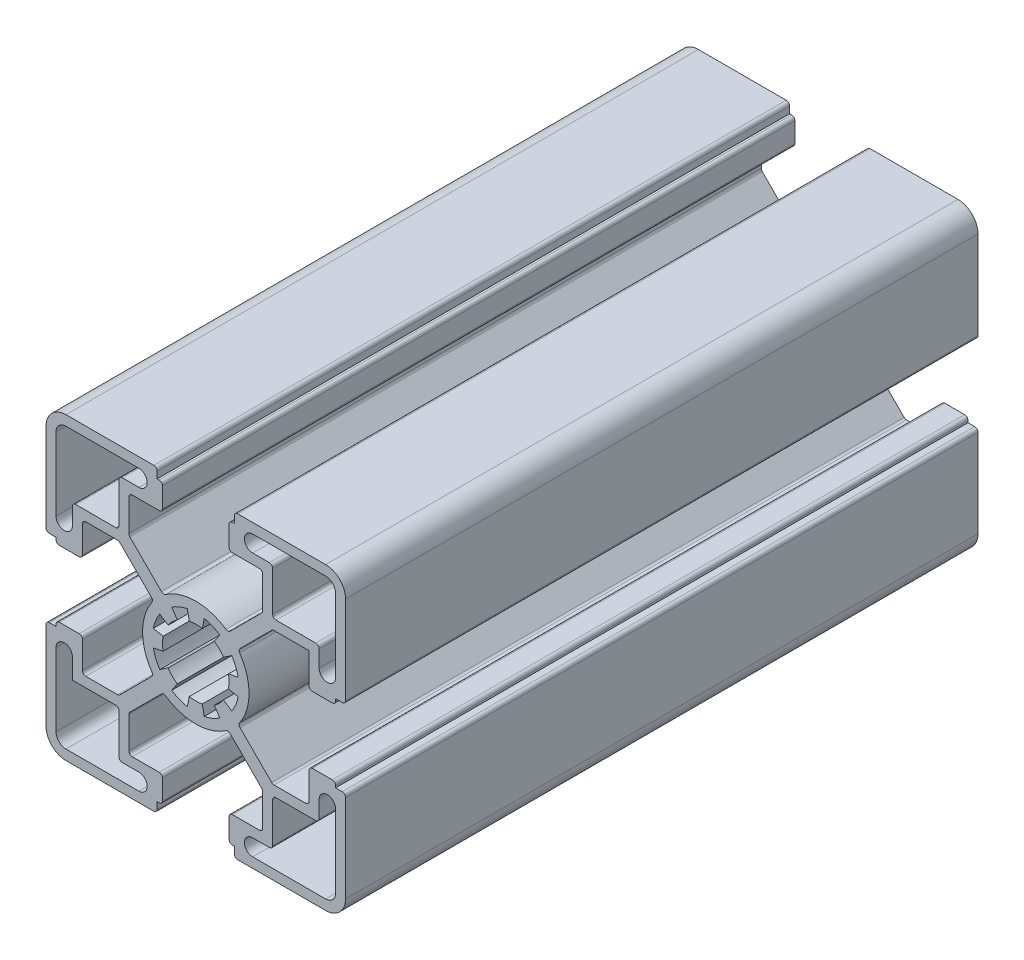
from build123d import *

# Parameters (mm, degrees)
BOSS_EXTRUDE1_DEPTH      = 47.5
BOSS_EXTRUDE1_DEPTH_BACK = 47.5
SKETCH3_R                = 5
FILLET1_R                = 0.5
CUT_EXTRUDE1_DEPTH       = 101.187324548


with BuildPart() as part:
    # Sketch3 → Boss-Extrude1 (new, two sides: drawn at the far end of the back side and taken through both)
    with BuildSketch(Plane.XY.offset(-BOSS_EXTRUDE1_DEPTH_BACK)):
        with BuildLine():
            Line((-11.55, -10.05), (-6.356915373, -4.856915373))
            ThreePointArc((-6.356915373, -4.856915373), (-8, 0), (-6.356915373, 4.856915373))
            Line((-6.356915373, 4.856915373), (-11.55, 10.05))
            Line((-11.55, 10.05), (-17.025, 10.05))
            Line((-17.025, 10.05), (-17.025, 5))
            Line((-17.025, 5), (-21, 5))
            Line((-21, 5), (-21, 5.8))
            Line((-21, 5.8), (-22.5, 5.8))
            Line((-22.5, 5.8), (-22.5, 19.5))
            ThreePointArc((-22.5, 19.5), (-21.621320344, 21.621320344), (-19.5, 22.5))
            Line((-19.5, 22.5), (-5.8, 22.5))
            Line((-5.8, 22.5), (-5.8, 21))
            Line((-5.8, 21), (-5, 21))
            Line((-5, 21), (-5, 17.025))
            Line((-5, 17.025), (-10.05, 17.025))
            Line((-10.05, 17.025), (-10.05, 11.55))
            Line((-10.05, 11.55), (-4.856915373, 6.356915373))
            ThreePointArc((-4.856915373, 6.356915373), (0, 8), (4.856915373, 6.356915373))
            Line((4.856915373, 6.356915373), (10.05, 11.55))
            Line((10.05, 11.55), (10.05, 17.025))
            Line((10.05, 17.025), (5, 17.025))
            Line((5, 17.025), (5, 21))
            Line((5, 21), (5.8, 21))
            Line((5.8, 21), (5.8, 22.5))
            Line((5.8, 22.5), (19.5, 22.5))
            ThreePointArc((19.5, 22.5), (21.621320344, 21.621320344), (22.5, 19.5))
            Line((22.5, 19.5), (22.5, 5.8))
            Line((22.5, 5.8), (21, 5.8))
            Line((21, 5.8), (21, 5))
            Line((21, 5), (17.025, 5))
            Line((17.025, 5), (17.025, 10.05))
            Line((17.025, 10.05), (11.55, 10.05))
            Line((11.55, 10.05), (6.356915373, 4.856915373))
            ThreePointArc((6.356915373, 4.856915373), (8, 0), (6.356915373, -4.856915373))
            Line((6.356915373, -4.856915373), (11.55, -10.05))
            Line((11.55, -10.05), (17.025, -10.05))
            Line((17.025, -10.05), (17.025, -5))
            Line((17.025, -5), (21, -5))
            Line((21, -5), (21, -5.8))
            Line((21, -5.8), (22.5, -5.8))
            Line((22.5, -5.8), (22.5, -19.5))
            ThreePointArc((22.5, -19.5), (21.621320344, -21.621320344), (19.5, -22.5))
            Line((19.5, -22.5), (5.8, -22.5))
            Line((5.8, -22.5), (5.8, -21))
            Line((5.8, -21), (5, -21))
            Line((5, -21), (5, -17.025))
            Line((5, -17.025), (10.05, -17.025))
            Line((10.05, -17.025), (10.05, -11.55))
            Line((10.05, -11.55), (4.856915373, -6.356915373))
            ThreePointArc((4.856915373, -6.356915373), (0, -8), (-4.856915373, -6.356915373))
            Line((-4.856915373, -6.356915373), (-10.05, -11.55))
            Line((-10.05, -11.55), (-10.05, -17.025))
            Line((-10.05, -17.025), (-5, -17.025))
            Line((-5, -17.025), (-5, -21))
            Line((-5, -21), (-5.8, -21))
            Line((-5.8, -21), (-5.8, -22.5))
            Line((-5.8, -22.5), (-19.5, -22.5))
            ThreePointArc((-19.5, -22.5), (-21.621320344, -21.621320344), (-22.5, -19.5))
            Line((-22.5, -19.5), (-22.5, -5.8))
            Line((-22.5, -5.8), (-21, -5.8))
            Line((-21, -5.8), (-21, -5))
            Line((-21, -5), (-17.025, -5))
            Line((-17.025, -5), (-17.025, -10.05))
            Line((-17.025, -10.05), (-11.55, -10.05))
        make_face()
        Circle(SKETCH3_R, mode=Mode.SUBTRACT)
        with BuildLine():
            Line((-21, 8.5375), (-21, 19.5))
            ThreePointArc((-21, 19.5), (-20.560660172, 20.560660172), (-19.5, 21))
            Line((-19.5, 21), (-8.5375, 21))
            ThreePointArc((-8.5375, 21), (-7.3, 19.7625), (-8.5375, 18.525))
            Line((-8.5375, 18.525), (-11.55, 18.525))
            Line((-11.55, 18.525), (-11.55, 11.55))
            Line((-11.55, 11.55), (-18.525, 11.55))
            Line((-18.525, 11.55), (-18.525, 8.5375))
            ThreePointArc((-18.525, 8.5375), (-19.7625, 7.3), (-21, 8.5375))
        make_face(mode=Mode.SUBTRACT)
        with BuildLine():
            Line((8.5375, 21), (19.5, 21))
            ThreePointArc((19.5, 21), (20.560660172, 20.560660172), (21, 19.5))
            Line((21, 19.5), (21, 8.5375))
            ThreePointArc((21, 8.5375), (19.7625, 7.3), (18.525, 8.5375))
            Line((18.525, 8.5375), (18.525, 11.55))
            Line((18.525, 11.55), (11.55, 11.55))
            Line((11.55, 11.55), (11.55, 18.525))
            Line((11.55, 18.525), (8.5375, 18.525))
            ThreePointArc((8.5375, 18.525), (7.3, 19.7625), (8.5375, 21))
        make_face(mode=Mode.SUBTRACT)
        with BuildLine():
            Line((21, -8.5375), (21, -19.5))
            ThreePointArc((21, -19.5), (20.560660172, -20.560660172), (19.5, -21))
            Line((19.5, -21), (8.5375, -21))
            ThreePointArc((8.5375, -21), (7.3, -19.7625), (8.5375, -18.525))
            Line((8.5375, -18.525), (11.55, -18.525))
            Line((11.55, -18.525), (11.55, -11.55))
            Line((11.55, -11.55), (18.525, -11.55))
            Line((18.525, -11.55), (18.525, -8.5375))
            ThreePointArc((18.525, -8.5375), (19.7625, -7.3), (21, -8.5375))
        make_face(mode=Mode.SUBTRACT)
        with BuildLine():
            Line((-8.5375, -21), (-19.5, -21))
            ThreePointArc((-19.5, -21), (-20.560660172, -20.560660172), (-21, -19.5))
            Line((-21, -19.5), (-21, -8.5375))
            ThreePointArc((-21, -8.5375), (-19.7625, -7.3), (-18.525, -8.5375))
            Line((-18.525, -8.5375), (-18.525, -11.55))
            Line((-18.525, -11.55), (-11.55, -11.55))
            Line((-11.55, -11.55), (-11.55, -18.525))
            Line((-11.55, -18.525), (-8.5375, -18.525))
            ThreePointArc((-8.5375, -18.525), (-7.3, -19.7625), (-8.5375, -21))
        make_face(mode=Mode.SUBTRACT)
    extrude(amount=BOSS_EXTRUDE1_DEPTH + BOSS_EXTRUDE1_DEPTH_BACK)

    # Fillet1
    fillet1_edges = [part.edges().sort_by_distance(p)[0] for p in [
        (-11.55, -18.525, 0),
        (-11.55, -11.55, 0),
        (18.525, -11.55, 0),
        (11.55, -11.55, 0),
        (11.55, -18.525, 0),
        (11.55, 18.525, 0),
        (11.55, 11.55, 0),
        (18.525, 11.55, 0),
        (-18.525, 11.55, 0),
        (-11.55, 11.55, 0),
        (-11.55, 18.525, 0),
        (6.356915373, -4.856915373, 0),
        (11.55, -10.05, 0),
        (17.025, -10.05, 0),
        (17.025, -5, 0),
        (21, -5, 0),
        (22.5, -5.8, 0),
        (5.8, -22.5, 0),
        (5, -21, 0),
        (5, -17.025, 0),
        (10.05, -17.025, 0),
        (10.05, -11.55, 0),
        (4.856915373, -6.356915373, 0),
        (-4.856915373, -6.356915373, 0),
        (-10.05, -11.55, 0),
        (-10.05, -17.025, 0),
        (-5, -17.025, 0),
        (-5, -21, 0),
        (-5.8, -22.5, 0),
        (-22.5, -5.8, 0),
        (-21, -5, 0),
        (-17.025, -5, 0),
        (-17.025, -10.05, 0),
        (-11.55, -10.05, 0),
        (-6.356915373, -4.856915373, 0),
        (-6.356915373, 4.856915373, 0),
        (-11.55, 10.05, 0),
        (-17.025, 10.05, 0),
        (-17.025, 5, 0),
        (-21, 5, 0),
        (-22.5, 5.8, 0),
        (-5.8, 22.5, 0),
        (-5, 21, 0),
        (-5, 17.025, 0),
        (-10.05, 17.025, 0),
        (-10.05, 11.55, 0),
        (-4.856915373, 6.356915373, 0),
        (4.856915373, 6.356915373, 0),
        (10.05, 11.55, 0),
        (10.05, 17.025, 0),
        (5, 17.025, 0),
        (5, 21, 0),
        (5.8, 22.5, 0),
        (22.5, 5.8, 0),
        (21, 5, 0),
        (17.025, 5, 0),
        (11.55, 10.05, 0),
        (6.356915373, 4.856915373, 0),
    ]]
    fillet(fillet1_edges, radius=FILLET1_R)

    # Sketch4 → Cut-Extrude1 (cut, through all)
    with BuildSketch(Plane.XY.offset(47.5)):
        with BuildLine():
            Line((-1.268087093, 6.375104323), (-0.97545161, 4.903926402))
            ThreePointArc((-0.97545161, 4.903926402), (-1.913417162, 4.619397663), (-2.777851165, 4.157348062))
            Line((-2.777851165, 4.157348062), (-3.611206515, 5.40455248))
            ThreePointArc((-3.611206515, 5.40455248), (-2.48744231, 6.005216961), (-1.268087093, 6.375104323))
        make_face()
        with BuildLine():
            Line((1.268087093, 6.375104323), (0.97545161, 4.903926402))
            ThreePointArc((0.97545161, 4.903926402), (1.913417162, 4.619397663), (2.777851165, 4.157348062))
            Line((2.777851165, 4.157348062), (3.611206515, 5.40455248))
            ThreePointArc((3.611206515, 5.40455248), (2.48744231, 6.005216961), (1.268087093, 6.375104323))
        make_face()
        with BuildLine():
            Line((5.40455248, 3.611206515), (4.157348062, 2.777851165))
            ThreePointArc((4.157348062, 2.777851165), (4.619397663, 1.913417162), (4.903926402, 0.97545161))
            Line((4.903926402, 0.97545161), (6.375104323, 1.268087093))
            ThreePointArc((6.375104323, 1.268087093), (6.005216961, 2.48744231), (5.40455248, 3.611206515))
        make_face()
        with BuildLine():
            Line((6.375104323, -1.268087093), (4.903926402, -0.97545161))
            ThreePointArc((4.903926402, -0.97545161), (4.619397663, -1.913417162), (4.157348062, -2.777851165))
            Line((4.157348062, -2.777851165), (5.40455248, -3.611206515))
            ThreePointArc((5.40455248, -3.611206515), (6.005216961, -2.48744231), (6.375104323, -1.268087093))
        make_face()
        with BuildLine():
            Line((3.611206515, -5.40455248), (2.777851165, -4.157348062))
            ThreePointArc((2.777851165, -4.157348062), (1.913417162, -4.619397663), (0.97545161, -4.903926402))
            Line((0.97545161, -4.903926402), (1.268087093, -6.375104323))
            ThreePointArc((1.268087093, -6.375104323), (2.48744231, -6.005216961), (3.611206515, -5.40455248))
        make_face()
        with BuildLine():
            Line((-1.268087093, -6.375104323), (-0.97545161, -4.903926402))
            ThreePointArc((-0.97545161, -4.903926402), (-1.913417162, -4.619397663), (-2.777851165, -4.157348062))
            Line((-2.777851165, -4.157348062), (-3.611206515, -5.40455248))
            ThreePointArc((-3.611206515, -5.40455248), (-2.48744231, -6.005216961), (-1.268087093, -6.375104323))
        make_face()
        with BuildLine():
            Line((-5.40455248, -3.611206515), (-4.157348062, -2.777851165))
            ThreePointArc((-4.157348062, -2.777851165), (-4.619397663, -1.913417162), (-4.903926402, -0.97545161))
            Line((-4.903926402, -0.97545161), (-6.375104323, -1.268087093))
            ThreePointArc((-6.375104323, -1.268087093), (-6.005216961, -2.48744231), (-5.40455248, -3.611206515))
        make_face()
        with BuildLine():
            Line((-6.375104323, 1.268087093), (-4.903926402, 0.97545161))
            ThreePointArc((-4.903926402, 0.97545161), (-4.619397663, 1.913417162), (-4.157348062, 2.777851165))
            Line((-4.157348062, 2.777851165), (-5.40455248, 3.611206515))
            ThreePointArc((-5.40455248, 3.611206515), (-6.005216961, 2.48744231), (-6.375104323, 1.268087093))
        make_face()
    extrude(amount=-CUT_EXTRUDE1_DEPTH, mode=Mode.SUBTRACT)


solid = part.part
